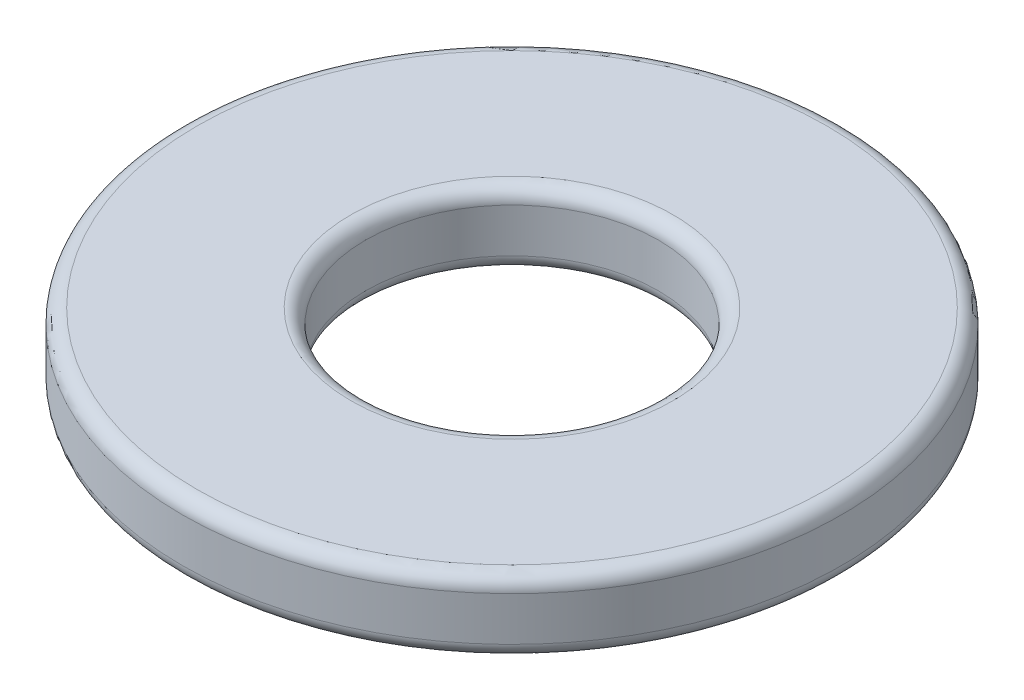
from build123d import *

# Parameters (mm, degrees)
SKETCH1_R           = 4.5
SKETCH1_R_2         = 2
BOSS_EXTRUDE1_DEPTH = 1
FILLET1_R           = 0.2


with BuildPart() as part:
    # Sketch1 → Boss-Extrude1 (new body)
    with BuildSketch(Plane(origin=(0, 0, 0), x_dir=(1, 0, 0), z_dir=(0, 1, 0))):
        with Locations(Location((0, 0, 0), (0, 0, 270))):
            Circle(SKETCH1_R)
        with Locations(Location((0, 0, 0), (0, 0, 270))):
            Circle(SKETCH1_R_2, mode=Mode.SUBTRACT)
    extrude(amount=BOSS_EXTRUDE1_DEPTH)

    # Fillet1
    fillet1_edges = [part.edges().sort_by_distance(p)[0] for p in [
        (0, 0, -4.5),
        (0, 1, -4.5),
        (0, 0, -2),
        (0, 1, -2),
    ]]
    fillet(fillet1_edges, radius=FILLET1_R)


solid = part.part
